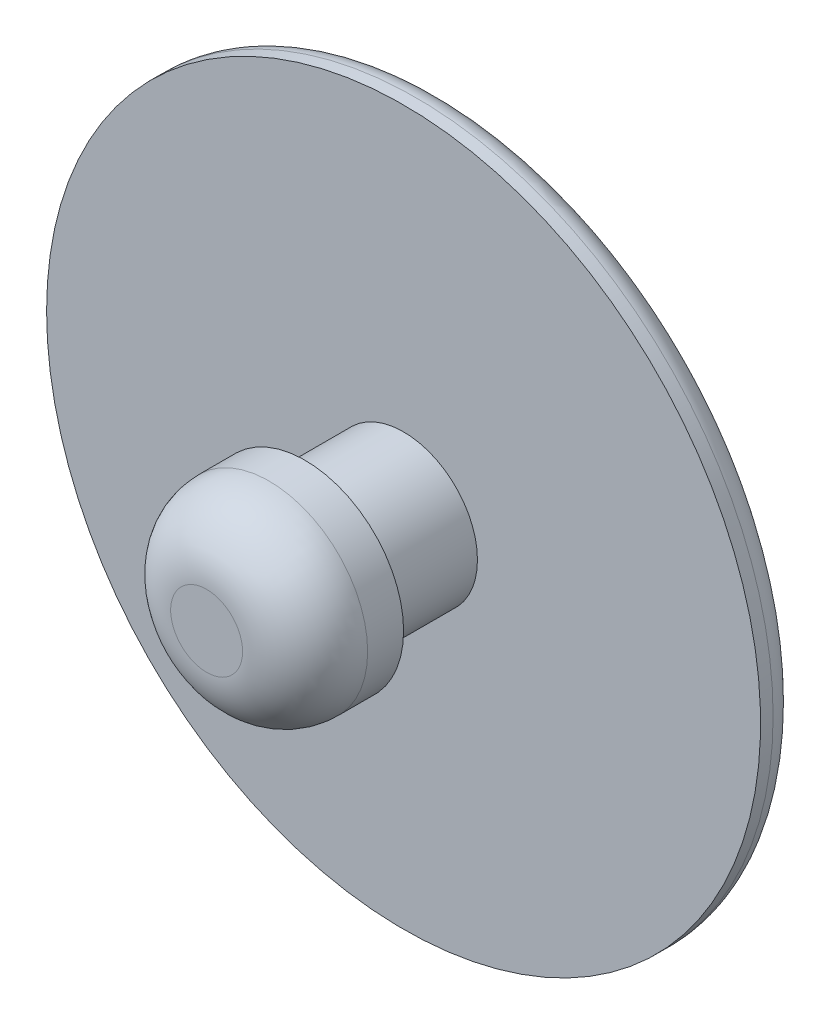
from build123d import *

# Parameters (mm, degrees)
SKETCH1_R           = 7.25
BOSS_EXTRUDE1_DEPTH = 0.762
FILLET1_R           = 0.508
SKETCH2_R           = 1.5
BOSS_EXTRUDE2_DEPTH = 2
SKETCH3_R           = 2
BOSS_EXTRUDE3_DEPTH = 2
FILLET2_R           = 1.27


with BuildPart() as part:
    # Sketch1 → Boss-Extrude1 (new body)
    with BuildSketch(Plane.XY):
        with Locations(Location((0, 0, 0), (0, 0, 180))):
            Circle(SKETCH1_R)
    extrude(amount=BOSS_EXTRUDE1_DEPTH)

    # Fillet1
    fillet1_edges = [part.edges().sort_by_distance(p)[0] for p in [
        (7.25, 0, 0),
    ]]
    fillet(fillet1_edges, radius=FILLET1_R)

    # Sketch2 → Boss-Extrude2 (add)
    with BuildSketch(Plane.XY.offset(0.762)):
        Circle(SKETCH2_R)
    extrude(amount=BOSS_EXTRUDE2_DEPTH)

    # Sketch3 → Boss-Extrude3 (add)
    with BuildSketch(Plane.XY.offset(2.762)):
        Circle(SKETCH3_R)
    extrude(amount=BOSS_EXTRUDE3_DEPTH)

    # Fillet2
    fillet2_edges = [part.edges().sort_by_distance(p)[0] for p in [
        (-2, 0, 4.762),
    ]]
    fillet(fillet2_edges, radius=FILLET2_R)


solid = part.part
